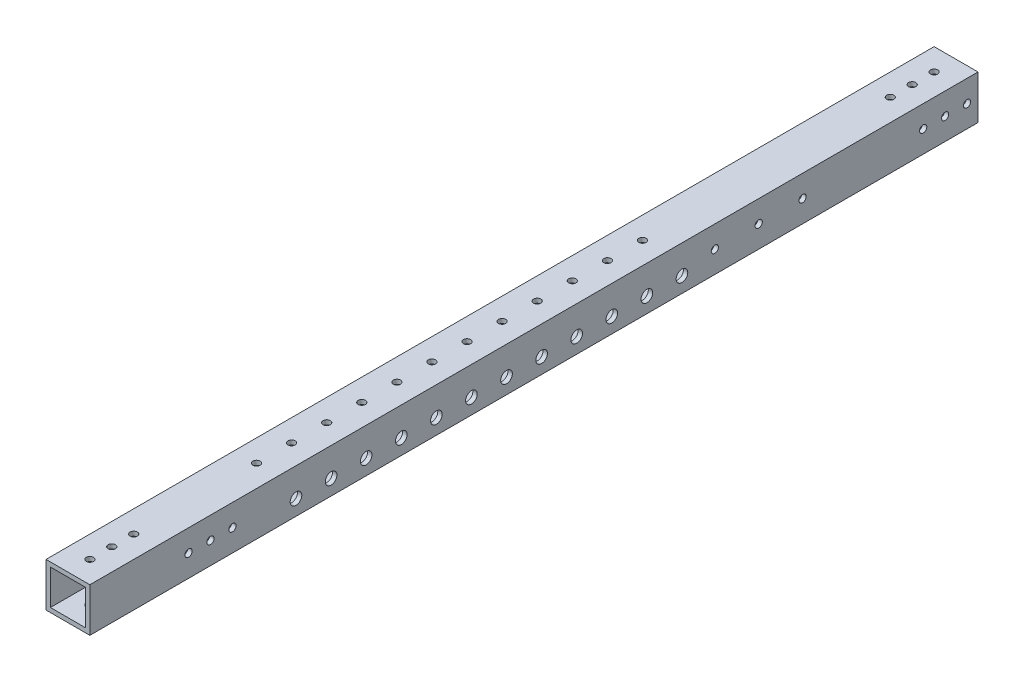
from build123d import *

# Parameters (mm, degrees)
SKETCH_1_W          = 20
SKETCH_1_H          = 20
SKETCH_1_W_2        = 16
SKETCH_1_H_2        = 16
EXTRUDE_1_DEPTH     = 405
SKETCH_2_R          = 1.65
CUT_EXTRUDE_1_DEPTH = 10
SKETCH_4_R          = 1.65
CUT_EXTRUDE_3_DEPTH = 10
SKETCH_10_R         = 1.65
SKETCH_10_R_2       = 2.65
CUT_EXTRUDE_4_DEPTH = 406.616814247
SKETCH_11_R         = 1.65
CUT_EXTRUDE_5_DEPTH = 406.616814247


with BuildPart() as part:
    # 草图1 → 凸台-拉伸1 (new body)
    with BuildSketch(Plane.XY):
        Rectangle(SKETCH_1_W, SKETCH_1_H)
        Rectangle(SKETCH_1_W_2, SKETCH_1_H_2, mode=Mode.SUBTRACT)
    extrude(amount=EXTRUDE_1_DEPTH)

    # 草图2 → 切除-拉伸1 (cut, symmetric)
    with BuildSketch(Plane(origin=(0, 0, 0), x_dir=(1, 0, 0), z_dir=(0, 1, 0))):
        with Locations(Location((0, -395, 0), (0, 0, 270))):
            Circle(SKETCH_2_R)
        with Locations(Location((0, -385, 0), (0, 0, 270))):
            Circle(SKETCH_2_R)
        with Locations(Location((0, -375, 0), (0, 0, 270))):
            Circle(SKETCH_2_R)
    extrude(amount=CUT_EXTRUDE_1_DEPTH, both=True, mode=Mode.SUBTRACT)

    # 草图4 → 切除-拉伸3 (cut, symmetric)
    with BuildSketch(Plane(origin=(0, 0, 0), x_dir=(1, 0, 0), z_dir=(0, 1, 0))):
        with Locations(Location((0, -10, 0), (0, 0, 270))):
            Circle(SKETCH_4_R)
        with Locations(Location((0, -20, 0), (0, 0, 270))):
            Circle(SKETCH_4_R)
        with Locations(Location((0, -30, 0), (0, 0, 270))):
            Circle(SKETCH_4_R)
    extrude(amount=CUT_EXTRUDE_3_DEPTH, both=True, mode=Mode.SUBTRACT)

    # 草图10 → 切除-拉伸4 (cut, through all)
    with BuildSketch(Plane(origin=(10, 0, 0), x_dir=(0, 0, -1), z_dir=(1, 0, 0))):
        with Locations((-120, 0)):
            Circle(SKETCH_10_R)
        with Locations((-100, 0)):
            Circle(SKETCH_10_R)
        with Locations((-80, 0)):
            Circle(SKETCH_10_R)
        with Locations((-135, -3)):
            Circle(SKETCH_10_R_2)
        with Locations((-151, -3)):
            Circle(SKETCH_10_R_2)
        with Locations((-167, -3)):
            Circle(SKETCH_10_R_2)
        with Locations((-183, -3)):
            Circle(SKETCH_10_R_2)
        with Locations((-199, -3)):
            Circle(SKETCH_10_R_2)
        with Locations((-215, -3)):
            Circle(SKETCH_10_R_2)
        with Locations((-231, -3)):
            Circle(SKETCH_10_R_2)
        with Locations((-247, -3)):
            Circle(SKETCH_10_R_2)
        with Locations((-263, -3)):
            Circle(SKETCH_10_R_2)
        with Locations((-279, -3)):
            Circle(SKETCH_10_R_2)
        with Locations((-295, -3)):
            Circle(SKETCH_10_R_2)
        with Locations((-311, -3)):
            Circle(SKETCH_10_R_2)
        with Locations((-360, 0)):
            Circle(SKETCH_10_R)
        with Locations((-350, 0)):
            Circle(SKETCH_10_R)
        with Locations((-340, 0)):
            Circle(SKETCH_10_R)
        with Locations((-5, 0)):
            Circle(SKETCH_10_R)
        with Locations((-15, 0)):
            Circle(SKETCH_10_R)
        with Locations((-25, 0)):
            Circle(SKETCH_10_R)
    extrude(amount=-CUT_EXTRUDE_4_DEPTH, mode=Mode.SUBTRACT)

    # 草图11 → 切除-拉伸5 (cut, through all)
    with BuildSketch(Plane(origin=(0, 10, 0), x_dir=(1, 0, 0), z_dir=(0, 1, 0))):
        with Locations(Location((0, -143, 0), (0, 0, 270))):
            Circle(SKETCH_11_R)
        with Locations(Location((0, -159, 0), (0, 0, 270))):
            Circle(SKETCH_11_R)
        with Locations(Location((0, -175, 0), (0, 0, 270))):
            Circle(SKETCH_11_R)
        with Locations(Location((0, -191, 0), (0, 0, 270))):
            Circle(SKETCH_11_R)
        with Locations(Location((0, -207, 0), (0, 0, 270))):
            Circle(SKETCH_11_R)
        with Locations(Location((0, -223, 0), (0, 0, 270))):
            Circle(SKETCH_11_R)
        with Locations(Location((0, -239, 0), (0, 0, 270))):
            Circle(SKETCH_11_R)
        with Locations(Location((0, -255, 0), (0, 0, 270))):
            Circle(SKETCH_11_R)
        with Locations(Location((0, -271, 0), (0, 0, 270))):
            Circle(SKETCH_11_R)
        with Locations(Location((0, -287, 0), (0, 0, 270))):
            Circle(SKETCH_11_R)
        with Locations(Location((0, -303, 0), (0, 0, 270))):
            Circle(SKETCH_11_R)
        with Locations(Location((0, -319, 0), (0, 0, 270))):
            Circle(SKETCH_11_R)
    extrude(amount=-CUT_EXTRUDE_5_DEPTH, mode=Mode.SUBTRACT)


solid = part.part
